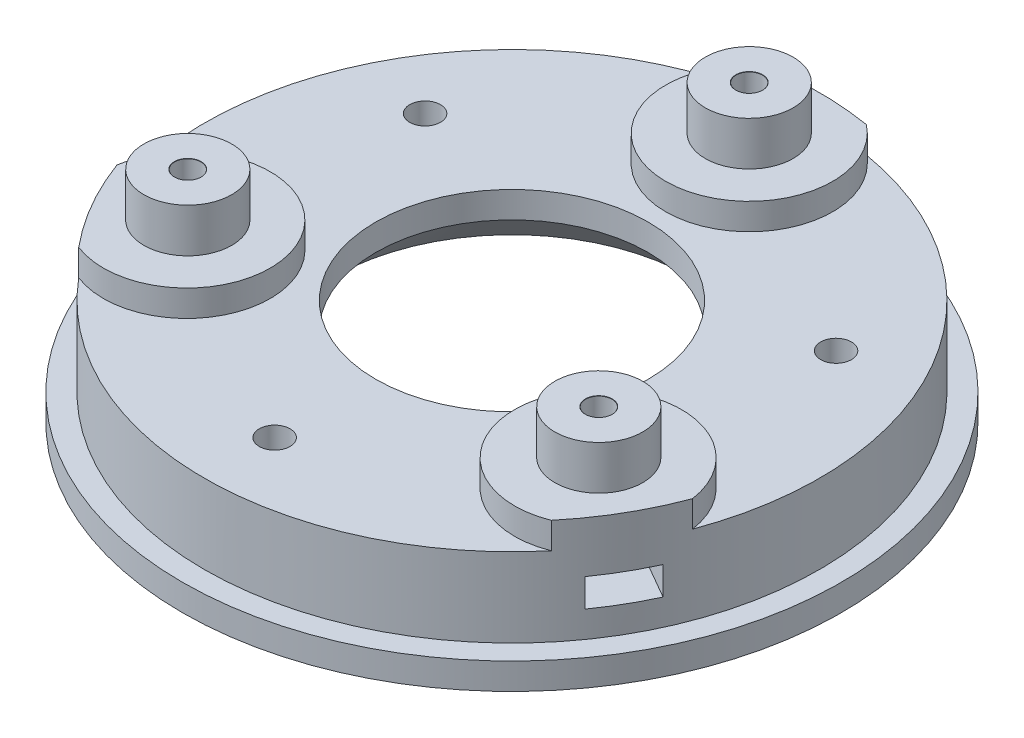
from build123d import *

# Parameters (mm, degrees)
SKETCH1_R                       = 37.5
BOSS_EXTRUDE1_DEPTH             = 3
SKETCH1_3_R                     = 35
BOSS_EXTRUDE2_DEPTH             = 12
SKETCH4_R                       = 15.5
CUT_EXTRUDE1_DEPTH              = 15
BOSS_EXTRUDE3_DEPTH             = 3
SKETCH18_R                      = 5
BOSS_EXTRUDE4_DEPTH             = 5
CHAMFER1_SIZE                   = 9
F_3_0MM_DOWEL_HOLE1_D           = 3
F_3_0MM_DOWEL_HOLE1_CSINK_D     = 3.05
F_3_0MM_DOWEL_HOLE1_CSINK_ANGLE = 90
SKETCH27_R                      = 1.75
CUT_EXTRUDE2_DEPTH              = 55.373706881
CUT_EXTRUDE3_START              = -6
SKETCH28_R                      = 1.5
CUT_EXTRUDE3_DEPTH              = 3.2
CIRPATTERN1_COUNT               = 3
SKETCH29_R                      = 32.5
CUT_EXTRUDE4_DEPTH              = 4
CHAMFER2_SIZE                   = 2


with BuildPart() as part:
    # Sketch1 → Boss-Extrude1 (new body)
    with BuildSketch(Plane(origin=(0, 0, 0), x_dir=(1, 0, 0), z_dir=(0, 1, 0))):
        with Locations(Location((0, 0, 0), (0, 0, 270))):
            Circle(SKETCH1_R)
    extrude(amount=BOSS_EXTRUDE1_DEPTH)

    # Sketch1<3> → Boss-Extrude2 (add)
    with BuildSketch(Plane(origin=(0, 0, 0), x_dir=(1, 0, 0), z_dir=(0, 1, 0))):
        with Locations(Location((0, 0, 0), (0, 0, 270))):
            Circle(SKETCH1_3_R)
    extrude(amount=BOSS_EXTRUDE2_DEPTH)

    # Sketch4 → Cut-Extrude1 (cut)
    with BuildSketch(Plane(origin=(0, 12, 0), x_dir=(1, 0, 0), z_dir=(0, 1, 0))):
        with Locations(Location((0, 0, 0), (0, 0, 270))):
            Circle(SKETCH4_R)
    extrude(amount=-CUT_EXTRUDE1_DEPTH, mode=Mode.SUBTRACT)

    # Sketch5 → Boss-Extrude3 (add)
    with BuildSketch(Plane(origin=(0, 12, 0), x_dir=(1, 0, 0), z_dir=(0, 1, 0))):
        with BuildLine():
            ThreePointArc((5.813043417, 34.513888889), (0, 35), (-5.813043417, 34.513888889))
            ThreePointArc((-5.813043417, 34.513888889), (0, 17.5), (5.813043417, 34.513888889))
        make_face()
        with BuildLine():
            ThreePointArc((-26.900782734, -22.390799188), (-15.223614965, -8.789358198), (-32.841392275, -12.101361636))
            ThreePointArc((-32.841392275, -12.101361636), (-30.310889132, -17.5), (-26.900782734, -22.390799188))
        make_face()
        with BuildLine():
            ThreePointArc((26.885233446, -22.409467253), (30.266672739, -17.576362574), (32.7884636, -12.244045686))
            ThreePointArc((32.7884636, -12.244045686), (15.167446159, -8.807989412), (26.885233446, -22.409467253))
        make_face()
    extrude(amount=BOSS_EXTRUDE3_DEPTH)

    # Sketch18 → Boss-Extrude4 (add)
    with BuildSketch(Plane(origin=(0, 15, 0), x_dir=(1, 0, 0), z_dir=(0, 1, 0))):
        with Locations(Location((0, 27, 0), (0, 0, 270))):
            Circle(SKETCH18_R)
        with Locations(Location((23.382685902, -13.5, 0), (0, 0, 270))):
            Circle(SKETCH18_R)
        with Locations(Location((-23.382685902, -13.5, 0), (0, 0, 270))):
            Circle(SKETCH18_R)
    extrude(amount=BOSS_EXTRUDE4_DEPTH)

    # Chamfer1
    chamfer1_edges = [part.edges().sort_by_distance(p)[0] for p in [
        (0, 0, -15.5),
    ]]
    chamfer(chamfer1_edges, length=CHAMFER1_SIZE)

    # Ø3.0mm Dowel Hole1 (through all)
    with Locations(Plane(origin=(0, 20, 0), x_dir=(1, 0, 0), z_dir=(0, 1, 0))):
        with Locations((0, 27), (-23.382685902, -13.5), (23.382685902, -13.5)):
            CounterSinkHole(F_3_0MM_DOWEL_HOLE1_D / 2, F_3_0MM_DOWEL_HOLE1_CSINK_D / 2, counter_sink_angle=F_3_0MM_DOWEL_HOLE1_CSINK_ANGLE)

    # Sketch27 → Cut-Extrude2 (cut, through all)
    with BuildSketch(Plane(origin=(0, 12, 0), x_dir=(1, 0, 0), z_dir=(0, 1, 0))):
        with Locations(Location((23.382685902, 13.5, 0), (0, 0, 270))):
            Circle(SKETCH27_R)
        with Locations(Location((0, -27, 0), (0, 0, 270))):
            Circle(SKETCH27_R)
        with Locations(Location((-23.382685902, 13.5, 0), (0, 0, 270))):
            Circle(SKETCH27_R)
    extrude(amount=-CUT_EXTRUDE2_DEPTH, mode=Mode.SUBTRACT)

    # Sketch28 → Cut-Extrude3 (cut)
    # profile 1 of 2: a face of its own
    with BuildSketch(Plane.XZ.offset(CUT_EXTRUDE3_START)):
        with BuildLine():
            Line((3.25, -37.358901215), (3.25, -28.876388375))
            Line((3.25, -28.876388375), (0, -30.75277675))
            Line((0, -30.75277675), (-3.25, -28.876388375))
            Line((-3.25, -28.876388375), (-3.25, -37.358901215))
            ThreePointArc((-3.25, -37.358901215), (0, -37.5), (3.25, -37.358901215))
        make_face()
    # profile 2 of 2: a face of its own
    with BuildSketch(Plane.XZ.offset(CUT_EXTRUDE3_START)):
        with BuildLine():
            Line((3.25, -28.876388375), (3.25, -25.123611625))
            Line((3.25, -25.123611625), (2.024716505, -24.41619387))
            ThreePointArc((2.024716505, -24.41619387), (0, -24.5), (-2.024716505, -24.41619387))
            Line((-2.024716505, -24.41619387), (-3.25, -25.123611625))
            Line((-3.25, -25.123611625), (-3.25, -28.876388375))
            Line((-3.25, -28.876388375), (0, -30.75277675))
            Line((0, -30.75277675), (3.25, -28.876388375))
        make_face()
        with Locations(Location((0, -27, 0), (0, 0, 90))):
            Circle(SKETCH28_R, mode=Mode.SUBTRACT)
    cut_extrude3 = extrude(amount=-CUT_EXTRUDE3_DEPTH, mode=Mode.SUBTRACT)

    # CirPattern1: Cut-Extrude3 ×3 about axis
    cirpattern1_axis = Axis((0, 0, 0), (0, 1, 0))
    for i in range(1, CIRPATTERN1_COUNT):
        add(cut_extrude3.rotate(cirpattern1_axis, i * 360 / CIRPATTERN1_COUNT), mode=Mode.SUBTRACT)

    # Sketch29 → Cut-Extrude4 (cut)
    with BuildSketch(Plane.XZ):
        with Locations(Location((0, 0, 0), (0, 0, 270))):
            Circle(SKETCH29_R)
    extrude(amount=-CUT_EXTRUDE4_DEPTH, mode=Mode.SUBTRACT)

    # Chamfer2
    chamfer2_edges = [part.edges().sort_by_distance(p)[0] for p in [
        (0, 4, 32.5),
    ]]
    chamfer(chamfer2_edges, length=CHAMFER2_SIZE)


solid = part.part
